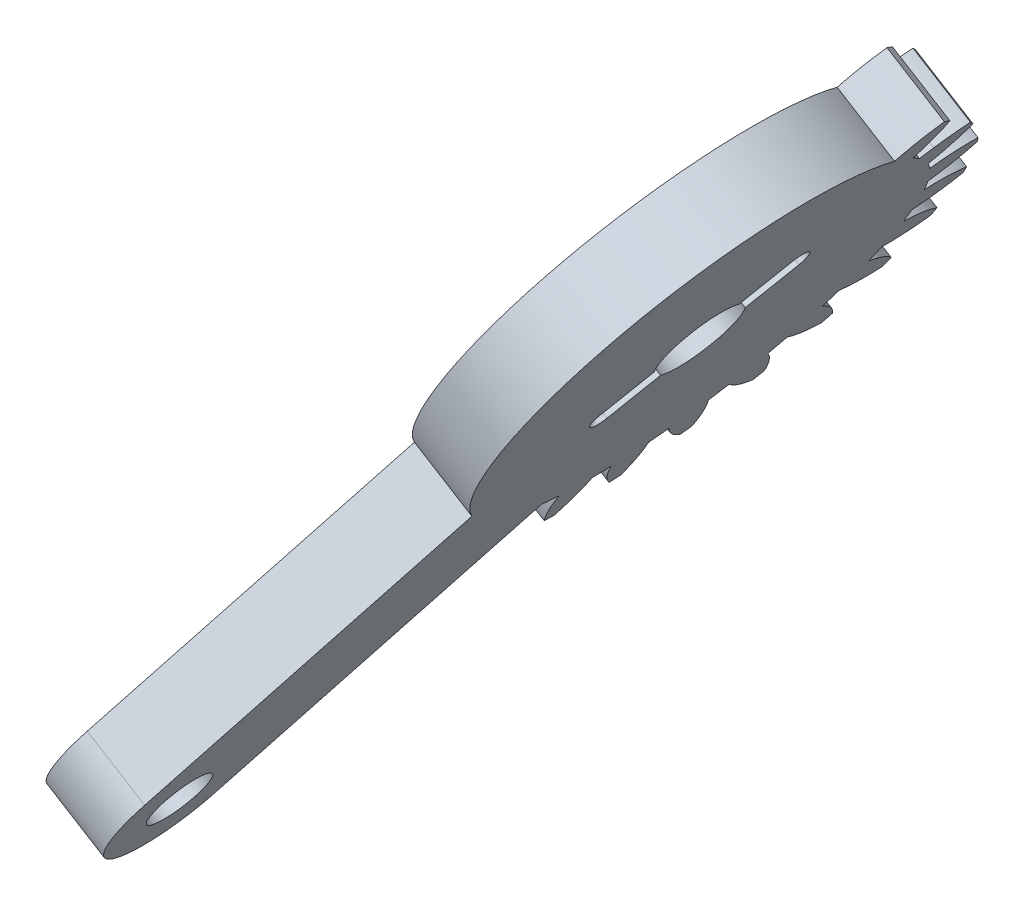
from build123d import *

# Parameters (mm, degrees)
SKETCH1_R           = 1.75
SKETCH1_R_2         = 2.4
BOSS_EXTRUDE1_DEPTH = 4
CUT_EXTRUDE1_DEPTH  = 10


with BuildPart() as part:
    # Sketch1 → Boss-Extrude1 (new body)
    with BuildSketch(Plane(origin=(-201.849311144, 125.418002604, 0.593848714), x_dir=(0.5277644625295516, 0.8493907652493602, 0), z_dir=(0.8493881131629323, -0.5277628146696672, -0.002498933665448049))):
        with BuildLine():
            Line((162.208427101, 97.881301323), (161.820912094, 98.53237983))
            ThreePointArc((161.820912094, 98.53237983), (162.176155218, 98.906966779), (162.515086857, 99.296374539))
            ThreePointArc((162.515086857, 99.296374539), (163.723385062, 98.699566989), (165.041833408, 98.420536953))
            ThreePointArc((165.041833408, 98.420536953), (165.22305653, 98.674638573), (165.398816038, 98.932549505))
            ThreePointArc((165.398816038, 98.932549505), (164.681084034, 100.073174148), (163.703268012, 101.000557365))
            ThreePointArc((163.703268012, 101.000557365), (161.330105787, 116.014599459), (146.152484133, 116.847161686))
            Line((146.152484133, 116.847161686), (130.289477893, 127.907081314))
            ThreePointArc((130.289477893, 127.907081314), (124.720550757, 126.913577135), (125.714054936, 121.344649999))
            Line((125.714054936, 121.344649999), (141.577061176, 110.284730371))
            ThreePointArc((141.577061176, 110.284730371), (141.428783224, 109.695705854), (141.310268829, 109.099978927))
            ThreePointArc((141.310268829, 109.099978927), (139.965448113, 109.012680325), (138.684123333, 108.595103251))
            ThreePointArc((138.684123333, 108.595103251), (138.654230316, 108.284433232), (138.630973584, 107.973196059))
            ThreePointArc((138.630973584, 107.973196059), (139.822860053, 107.344252144), (141.133365177, 107.03002273))
            ThreePointArc((141.133365177, 107.03002273), (141.145956651, 106.487309655), (141.182892388, 105.945708529))
            ThreePointArc((141.182892388, 105.945708529), (139.906489868, 105.513319341), (138.776902071, 104.778339605))
            ThreePointArc((138.776902071, 104.778339605), (138.828434951, 104.470518528), (138.88652478, 104.163867219))
            ThreePointArc((138.88652478, 104.163867219), (140.200581367, 103.864836966), (141.547760668, 103.900498345))
            ThreePointArc((141.547760668, 103.900498345), (141.700387578, 103.379536682), (141.876241447, 102.86594984))
            ThreePointArc((141.876241447, 102.86594984), (140.755241845, 102.117936675), (139.854370572, 101.115641931))
            ThreePointArc((139.854370572, 101.115641931), (139.983817469, 100.831647293), (140.119295134, 100.550479629))
            ThreePointArc((140.119295134, 100.550479629), (141.465971053, 100.601741456), (142.758016489, 100.984863363))
            ThreePointArc((142.758016489, 100.984863363), (143.040277563, 100.521155789), (143.343065412, 100.070583325))
            ThreePointArc((143.343065412, 100.070583325), (142.453862998, 99.057922043), (141.843101138, 97.856617022))
            ThreePointArc((141.843101138, 97.856617022), (142.04164046, 97.61580259), (142.245273383, 97.379279681))
            ThreePointArc((142.245273383, 97.379279681), (143.532794895, 97.777340179), (144.681655704, 98.481813489))
            ThreePointArc((144.681655704, 98.481813489), (145.074315316, 98.10696091), (145.483402655, 97.750108592))
            ThreePointArc((145.483402655, 97.750108592), (144.886595105, 96.541810387), (144.607565069, 95.22336204))
            ThreePointArc((144.607565069, 95.22336204), (144.861666689, 95.042138918), (145.119577621, 94.866379411))
            ThreePointArc((145.119577621, 94.866379411), (146.260202264, 95.584111414), (147.18758548, 96.561927437))
            ThreePointArc((147.18758548, 96.561927437), (147.663884528, 96.301475435), (148.15139273, 96.062662159))
            ThreePointArc((148.15139273, 96.062662159), (147.887651491, 94.741070557), (147.959368715, 93.395328961))
            ThreePointArc((147.959368715, 93.395328961), (148.251716028, 93.286047206), (148.546328766, 93.183028819))
            ThreePointArc((148.546328766, 93.183028819), (149.462324855, 94.171520079), (150.105030845, 95.356042267))
            ThreePointArc((150.105030845, 95.356042267), (150.632510335, 95.227740216), (151.165216521, 95.123240713))
            ThreePointArc((151.165216521, 95.123240713), (151.252515124, 93.778419997), (151.670092198, 92.497095217))
            ThreePointArc((151.670092198, 92.497095217), (151.980762217, 92.4672022), (152.29199939, 92.443945468))
            ThreePointArc((152.29199939, 92.443945468), (152.920943305, 93.635831937), (153.235172718, 94.946337061))
            ThreePointArc((153.235172718, 94.946337061), (153.777885794, 94.958928535), (154.319486919, 94.995864272))
            ThreePointArc((154.319486919, 94.995864272), (154.751876108, 93.719461752), (155.486855844, 92.589873955))
            ThreePointArc((155.486855844, 92.589873955), (155.794676921, 92.641406835), (156.10132823, 92.699496665))
            ThreePointArc((156.10132823, 92.699496665), (156.400358482, 94.013553251), (156.364697104, 95.360732552))
            ThreePointArc((156.364697104, 95.360732552), (156.885658766, 95.513359462), (157.399245608, 95.689213331))
            ThreePointArc((157.399245608, 95.689213331), (158.147258774, 94.568213729), (159.149553518, 93.667342456))
            ThreePointArc((159.149553518, 93.667342456), (159.433548155, 93.796789353), (159.71471582, 93.932267018))
            ThreePointArc((159.71471582, 93.932267018), (159.663453993, 95.278942937), (159.280332086, 96.570988373))
            ThreePointArc((159.280332086, 96.570988373), (159.744039659, 96.853249447), (160.194612124, 97.156037296))
            ThreePointArc((160.194612124, 97.156037296), (161.207273405, 96.266834883), (162.408578427, 95.656073022))
            ThreePointArc((162.408578427, 95.656073022), (162.649392859, 95.854612345), (162.885915768, 96.058245267))
            ThreePointArc((162.885915768, 96.058245267), (162.629922136, 97.000525318), (162.208427101, 97.881301323))
        make_face()
        with Locations(Location((128.001766415, 124.625865657, 0), (0, 0, 180))):
            Circle(SKETCH1_R, mode=Mode.SUBTRACT)
        with Locations(Location((153.226111782, 107.039083666, 0), (0, 0, 180))):
            Circle(SKETCH1_R_2, mode=Mode.SUBTRACT)
    extrude(amount=-BOSS_EXTRUDE1_DEPTH)

    # Sketch3 → Cut-Extrude1 (cut)
    with BuildSketch(Plane(origin=(-201.849311144, 125.418002604, 0.593848714), x_dir=(-0.0021225711784023066, 0.0013188483828421916, -0.9999968776603934), z_dir=(0.8493881131629325, -0.527762814669667, -0.002498933665448049))):
        with BuildLine():
            Line((-111.455565577, 150.432166351), (-103.598152949, 157.159486839))
            ThreePointArc((-103.598152949, 157.159486839), (-102.54066254, 157.077547623), (-102.622601756, 156.020057214))
            Line((-102.622601756, 156.020057214), (-110.480014384, 149.292736726))
            ThreePointArc((-110.480014384, 149.292736726), (-111.537504793, 149.374675942), (-111.455565577, 150.432166351))
        make_face()
    extrude(amount=-CUT_EXTRUDE1_DEPTH, mode=Mode.SUBTRACT)


solid = part.part
